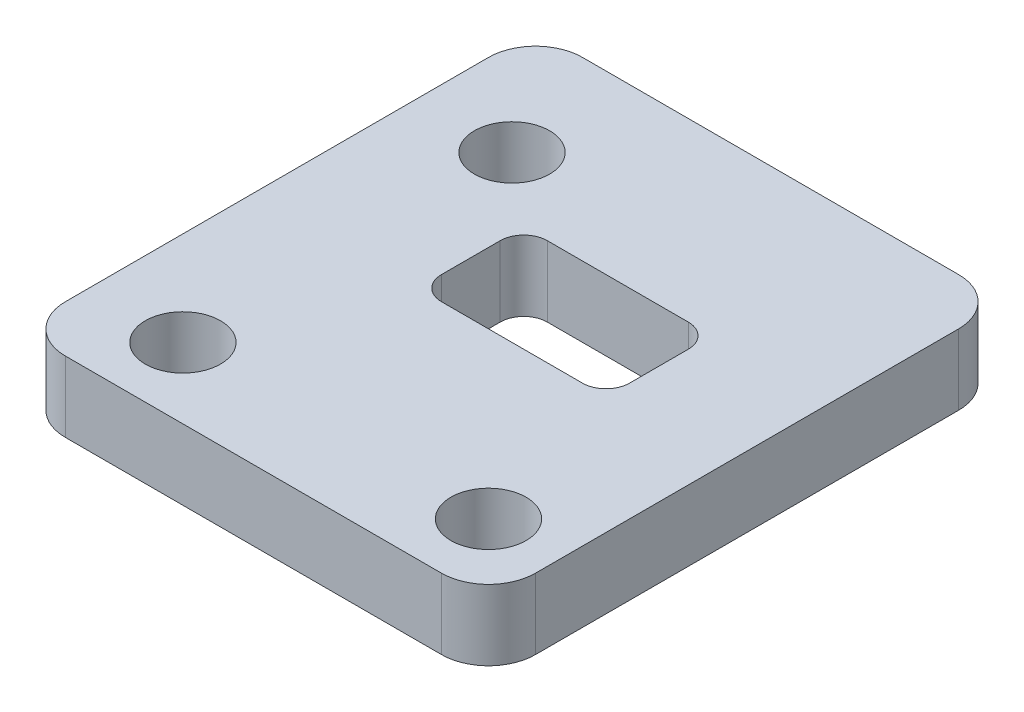
from build123d import *

# Parameters (mm, degrees)
SKETCH_2_W      = 20
SKETCH_2_H      = 22
SKETCH_2_R      = 1.6
SKETCH_2_W_2    = 8
SKETCH_2_H_2    = 4.5
EXTRUDE_1_DEPTH = 3
FILLET_1_R      = 2
FILLET_2_R      = 1


with BuildPart() as part:
    # 草图2 → 凸台-拉伸1 (new body)
    with BuildSketch(Plane(origin=(0, 0, 0), x_dir=(1, 0, 0), z_dir=(0, 1, 0))):
        with Locations((0, 1)):
            Rectangle(SKETCH_2_W, SKETCH_2_H)
        with Locations(Location((-6, -7, 0), (0, 0, 270))):
            Circle(SKETCH_2_R, mode=Mode.SUBTRACT)
        with Locations(Location((7, -7, 0), (0, 0, 270))):
            Circle(SKETCH_2_R, mode=Mode.SUBTRACT)
        with Locations(Location((-6, 7, 0), (0, 0, 270))):
            Circle(SKETCH_2_R, mode=Mode.SUBTRACT)
        with Locations((1, 2.25)):
            Rectangle(SKETCH_2_W_2, SKETCH_2_H_2, mode=Mode.SUBTRACT)
    extrude(amount=EXTRUDE_1_DEPTH)

    # 圆角1
    fillet_1_edges = [part.edges().sort_by_distance(p)[0] for p in [
        (10, 1.5, 10),
        (-10, 1.5, 10),
        (-10, 1.5, -12),
        (10, 1.5, -12),
    ]]
    fillet(fillet_1_edges, radius=FILLET_1_R)

    # 圆角2
    fillet_2_edges = [part.edges().sort_by_distance(p)[0] for p in [
        (5, 1.5, -4.5),
        (-3, 1.5, -4.5),
        (-3, 1.5, 0),
        (5, 1.5, 0),
    ]]
    fillet(fillet_2_edges, radius=FILLET_2_R)


solid = part.part
